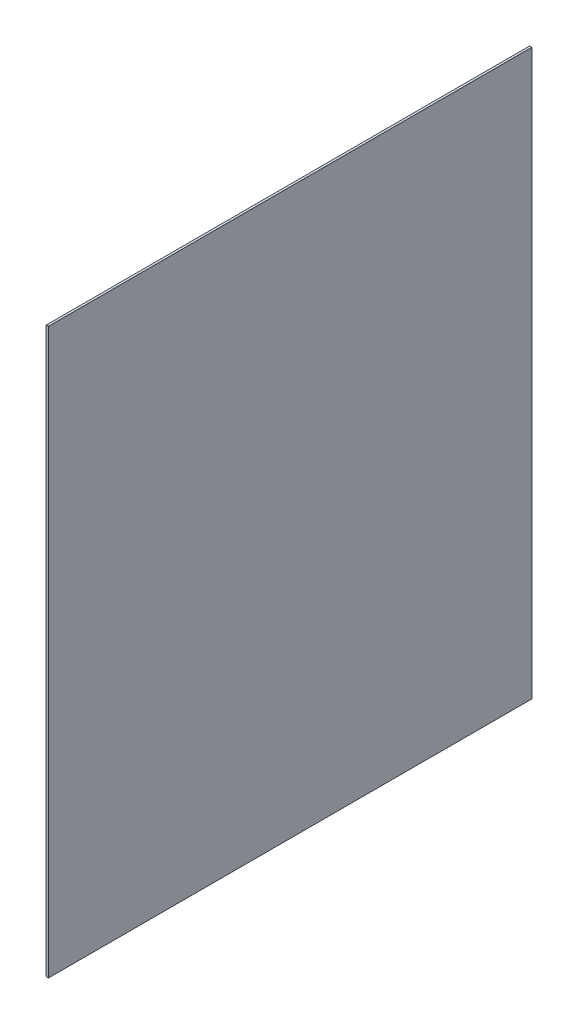
from build123d import *

# Parameters (mm, degrees)
BOSS_EXTRUDE2_START = 77.7
BOSS_EXTRUDE2_DEPTH = 1.5


with BuildPart() as part:
    # Sketch2 → Boss-Extrude2 (new body)
    with BuildSketch(Plane(origin=(1335, 0, 0), x_dir=(0, 0, -1), z_dir=(1, 0, 0)).offset(BOSS_EXTRUDE2_START)):
        Polygon((159.995106229, 180.107485478), (160.008232285, 553.761760903), (-160.008232285, 553.761760903), (-159.995106229, 180.107485478), align=None)
    extrude(amount=BOSS_EXTRUDE2_DEPTH)


solid = part.part
